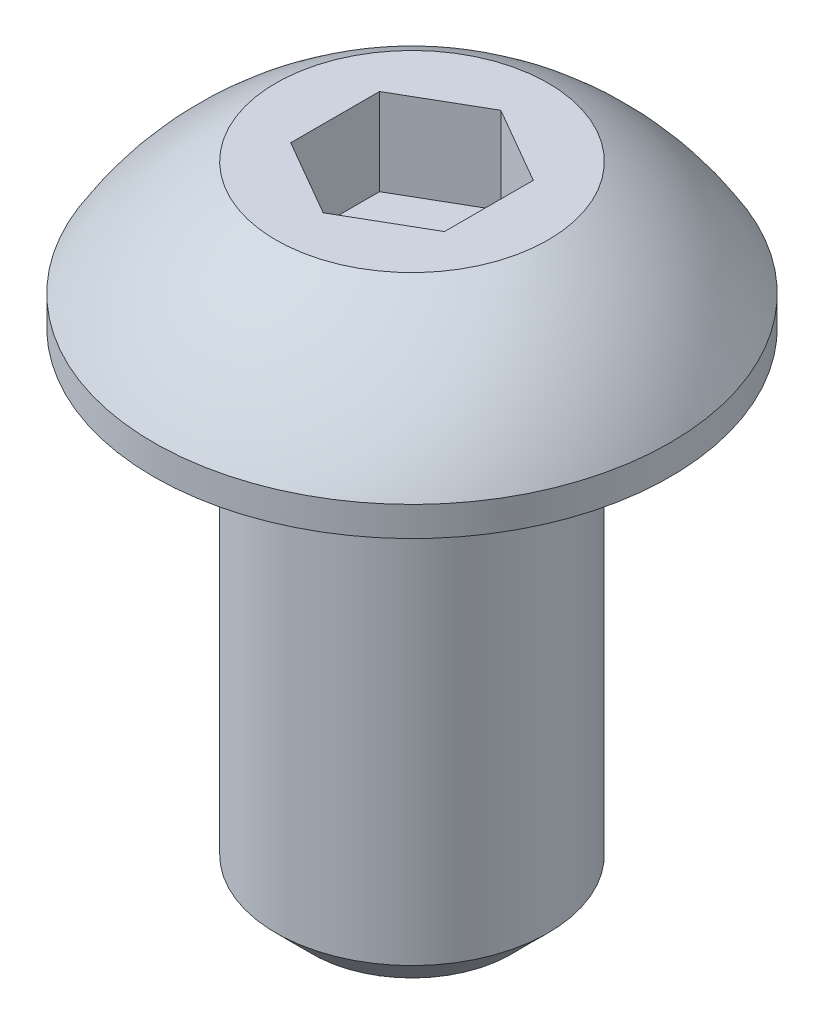
from build123d import *

# Parameters (mm, degrees)
CUT_EXTRUDE1_DEPTH = 1.117599032


with BuildPart() as part:
    # Sketch1 → Base-Revolve (revolve)
    with BuildSketch(Plane.XY, mode=Mode.PRIVATE) as base_revolve_sk:
        with BuildLine():
            Line((0, 0), (3.327397118, 0))
            Line((3.327397118, 0), (3.327397118, 0.38099967))
            ThreePointArc((3.327397118, 0.38099967), (2.644648832, 1.229467376), (1.752598482, 1.854198394))
            Line((1.752598482, 1.854198394), (0, 1.854198394))
            Line((0, 1.854198394), (0, 0))
        make_face()
    revolve(base_revolve_sk.sketch.rotate(Axis((0, 0, 0), (0, 1, 0)), 90), axis=Axis((0, 0, 0), (0, 1, 0)))

    # Sketch2 → Boss-Revolve1 (revolve)
    with BuildSketch(Plane.XY, mode=Mode.PRIVATE) as boss_revolve1_sk:
        Polygon((0, -6.3499945), (1.280158891, -6.3499945), (1.752598482, -5.877554909), (1.752598482, 0), (0, 0), align=None)
    revolve(boss_revolve1_sk.sketch.rotate(Axis((0, 0, 0), (0, 1, 0)), 90), axis=Axis((0, 0, 0), (0, 1, 0)))

    # Sketch3 → Cut-Extrude1 (cut)
    with BuildSketch(Plane(origin=(0, 1.854198394, 0), x_dir=(-1, 0, 0), z_dir=(0, 1, 0))):
        Polygon((0.990599142, 0.571922681), (0, 1.143845363), (-0.990599142, 0.571922681), (-0.990599142, -0.571922681), (0, -1.143845363), (0.990599142, -0.571922681), align=None)
    extrude(amount=-CUT_EXTRUDE1_DEPTH, mode=Mode.SUBTRACT)


solid = part.part
